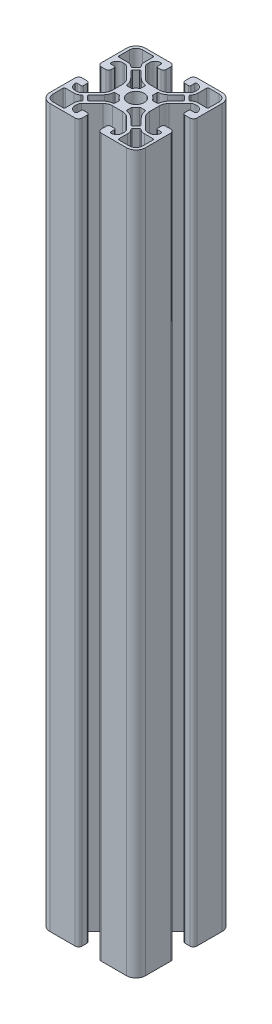
from build123d import *

# Parameters (mm, degrees)
BOSS_EXTRUDE1_DEPTH = 300


with BuildPart() as part:
    # Sketch1 → Boss-Extrude1 (new body)
    with BuildSketch(Plane.XZ):
        with BuildLine():
            ThreePointArc((7.74999966, 2.143146426), (8.054481613, 3.673880349), (8.921572842, 4.971573842))
            Line((8.921572842, 4.971573842), (13.364213585, 9.414213585))
            ThreePointArc((13.364213585, 9.414213585), (14.013060246, 9.847758984), (14.778427028, 9.99999988))
            Line((14.778427028, 9.99999988), (15.49999999, 9.99999988))
            ThreePointArc((15.49999999, 9.99999988), (17.267766945, 9.267766835), (18, 7.499999885))
            ThreePointArc((18, 7.499999885), (17.853553391, 7.146446491), (17.499999998, 6.99999988))
            Line((17.499999998, 6.99999988), (16.000000002, 6.99999988))
            ThreePointArc((16.000000002, 6.99999988), (15.64644661, 6.85355327), (15.5, 6.499999878))
            Line((15.5, 6.499999878), (15.5, 4.999999884))
            ThreePointArc((15.5, 4.999999884), (15.79289322, 4.2928931), (16.500000004, 3.99999988))
            Line((16.500000004, 3.99999988), (18.499999994, 3.99999988))
            ThreePointArc((18.499999994, 3.99999988), (19.56066017, 4.43933971), (20, 5.499999886))
            Line((20, 5.499999886), (20, 16))
            ThreePointArc((20, 16), (18.828427125, 18.828427125), (16, 20))
            Line((16, 20), (5.500000703, 20))
            ThreePointArc((5.500000703, 20), (4.439339115, 19.560659585), (3.9999987, 18.499997997))
            Line((3.9999987, 18.499997997), (3.9999987, 16.500000004))
            ThreePointArc((3.9999987, 16.500000004), (4.29289192, 15.79289322), (4.999998704, 15.5))
            Line((4.999998704, 15.5), (6.499998698, 15.5))
            ThreePointArc((6.499998698, 15.5), (6.85355209, 15.64644661), (6.9999987, 16.000000002))
            Line((6.9999987, 16.000000002), (6.9999987, 17.499999998))
            ThreePointArc((6.9999987, 17.499999998), (7.146445288, 17.853553368), (7.49999864, 18))
            ThreePointArc((7.49999864, 18), (9.2677658, 17.26776706), (9.99999896, 15.49999999))
            Line((9.99999896, 15.49999999), (9.99999896, 14.778427028))
            ThreePointArc((9.99999896, 14.778427028), (9.847758064, 14.013060246), (9.414212665, 13.364213585))
            Line((9.414212665, 13.364213585), (4.971572922, 8.921572842))
            ThreePointArc((4.971572922, 8.921572842), (3.673879429, 8.054481613), (2.143145506, 7.74999966))
            Line((2.143145506, 7.74999966), (-2.143146426, 7.74999966))
            ThreePointArc((-2.143146426, 7.74999966), (-3.673880349, 8.054481613), (-4.971573842, 8.921572842))
            Line((-4.971573842, 8.921572842), (-9.414213585, 13.364213585))
            ThreePointArc((-9.414213585, 13.364213585), (-9.847758984, 14.013060246), (-9.99999988, 14.778427028))
            Line((-9.99999988, 14.778427028), (-9.99999988, 15.49999999))
            ThreePointArc((-9.99999988, 15.49999999), (-9.267766835, 17.267766945), (-7.499999885, 18))
            ThreePointArc((-7.499999885, 18), (-7.146446491, 17.853553391), (-6.99999988, 17.499999998))
            Line((-6.99999988, 17.499999998), (-6.99999988, 16.000000002))
            ThreePointArc((-6.99999988, 16.000000002), (-6.85355327, 15.64644661), (-6.499999878, 15.5))
            Line((-6.499999878, 15.5), (-4.999999884, 15.5))
            ThreePointArc((-4.999999884, 15.5), (-4.2928931, 15.79289322), (-3.99999988, 16.500000004))
            Line((-3.99999988, 16.500000004), (-3.99999988, 18.499999994))
            ThreePointArc((-3.99999988, 18.499999994), (-4.43933971, 19.56066017), (-5.499999886, 20))
            Line((-5.499999886, 20), (-16, 20))
            ThreePointArc((-16, 20), (-18.828427125, 18.828427125), (-20, 16))
            Line((-20, 16), (-20, 5.500000703))
            ThreePointArc((-20, 5.500000703), (-19.560659585, 4.439339115), (-18.499997997, 3.9999987))
            Line((-18.499997997, 3.9999987), (-16.500000004, 3.9999987))
            ThreePointArc((-16.500000004, 3.9999987), (-15.79289322, 4.29289192), (-15.5, 4.999998704))
            Line((-15.5, 4.999998704), (-15.5, 6.499998698))
            ThreePointArc((-15.5, 6.499998698), (-15.64644661, 6.85355209), (-16.000000002, 6.9999987))
            Line((-16.000000002, 6.9999987), (-17.499999998, 6.9999987))
            ThreePointArc((-17.499999998, 6.9999987), (-17.853553368, 7.146445288), (-18, 7.49999864))
            ThreePointArc((-18, 7.49999864), (-17.26776706, 9.2677658), (-15.49999999, 9.99999896))
            Line((-15.49999999, 9.99999896), (-14.778427028, 9.99999896))
            ThreePointArc((-14.778427028, 9.99999896), (-14.013060246, 9.847758064), (-13.364213585, 9.414212665))
            Line((-13.364213585, 9.414212665), (-8.921572842, 4.971572922))
            ThreePointArc((-8.921572842, 4.971572922), (-8.054481613, 3.673879429), (-7.74999966, 2.143145506))
            Line((-7.74999966, 2.143145506), (-7.74999966, -2.143146426))
            ThreePointArc((-7.74999966, -2.143146426), (-8.054481613, -3.673880349), (-8.921572842, -4.971573842))
            Line((-8.921572842, -4.971573842), (-13.364213585, -9.414213585))
            ThreePointArc((-13.364213585, -9.414213585), (-14.013060246, -9.847758984), (-14.778427028, -9.99999988))
            Line((-14.778427028, -9.99999988), (-15.49999999, -9.99999988))
            ThreePointArc((-15.49999999, -9.99999988), (-17.267766945, -9.267766835), (-18, -7.499999885))
            ThreePointArc((-18, -7.499999885), (-17.853553391, -7.146446491), (-17.499999998, -6.99999988))
            Line((-17.499999998, -6.99999988), (-16.000000002, -6.99999988))
            ThreePointArc((-16.000000002, -6.99999988), (-15.64644661, -6.85355327), (-15.5, -6.499999878))
            Line((-15.5, -6.499999878), (-15.5, -4.999999884))
            ThreePointArc((-15.5, -4.999999884), (-15.79289322, -4.2928931), (-16.500000004, -3.99999988))
            Line((-16.500000004, -3.99999988), (-18.499999994, -3.99999988))
            ThreePointArc((-18.499999994, -3.99999988), (-19.56066017, -4.43933971), (-20, -5.499999886))
            Line((-20, -5.499999886), (-20, -16))
            ThreePointArc((-20, -16), (-18.828427125, -18.828427125), (-16, -20))
            Line((-16, -20), (-5.500000703, -20))
            ThreePointArc((-5.500000703, -20), (-4.439339115, -19.560659585), (-3.9999987, -18.499997997))
            Line((-3.9999987, -18.499997997), (-3.9999987, -16.500000004))
            ThreePointArc((-3.9999987, -16.500000004), (-4.29289192, -15.79289322), (-4.999998704, -15.5))
            Line((-4.999998704, -15.5), (-6.499998698, -15.5))
            ThreePointArc((-6.499998698, -15.5), (-6.85355209, -15.64644661), (-6.9999987, -16.000000002))
            Line((-6.9999987, -16.000000002), (-6.9999987, -17.499999998))
            ThreePointArc((-6.9999987, -17.499999998), (-7.146445288, -17.853553368), (-7.49999864, -18))
            ThreePointArc((-7.49999864, -18), (-9.2677658, -17.26776706), (-9.99999896, -15.49999999))
            Line((-9.99999896, -15.49999999), (-9.99999896, -14.778427028))
            ThreePointArc((-9.99999896, -14.778427028), (-9.847758064, -14.013060246), (-9.414212665, -13.364213585))
            Line((-9.414212665, -13.364213585), (-4.971572922, -8.921572842))
            ThreePointArc((-4.971572922, -8.921572842), (-3.673879429, -8.054481613), (-2.143145506, -7.74999966))
            Line((-2.143145506, -7.74999966), (2.143146426, -7.74999966))
            ThreePointArc((2.143146426, -7.74999966), (3.673880349, -8.054481613), (4.971573842, -8.921572842))
            Line((4.971573842, -8.921572842), (9.414213585, -13.364213585))
            ThreePointArc((9.414213585, -13.364213585), (9.847758984, -14.013060246), (9.99999988, -14.778427028))
            Line((9.99999988, -14.778427028), (9.99999988, -15.49999999))
            ThreePointArc((9.99999988, -15.49999999), (9.267766835, -17.267766945), (7.499999885, -18))
            ThreePointArc((7.499999885, -18), (7.146446491, -17.853553391), (6.99999988, -17.499999998))
            Line((6.99999988, -17.499999998), (6.99999988, -16.000000002))
            ThreePointArc((6.99999988, -16.000000002), (6.85355327, -15.64644661), (6.499999878, -15.5))
            Line((6.499999878, -15.5), (4.999999884, -15.5))
            ThreePointArc((4.999999884, -15.5), (4.2928931, -15.79289322), (3.99999988, -16.500000004))
            Line((3.99999988, -16.500000004), (3.99999988, -18.499999994))
            ThreePointArc((3.99999988, -18.499999994), (4.43933971, -19.56066017), (5.499999886, -20))
            Line((5.499999886, -20), (16, -20))
            ThreePointArc((16, -20), (18.828427125, -18.828427125), (20, -16))
            Line((20, -16), (20, -5.500000703))
            ThreePointArc((20, -5.500000703), (19.560659585, -4.439339115), (18.499997997, -3.9999987))
            Line((18.499997997, -3.9999987), (16.500000004, -3.9999987))
            ThreePointArc((16.500000004, -3.9999987), (15.79289322, -4.29289192), (15.5, -4.999998704))
            Line((15.5, -4.999998704), (15.5, -6.499998698))
            ThreePointArc((15.5, -6.499998698), (15.64644661, -6.85355209), (16.000000002, -6.9999987))
            Line((16.000000002, -6.9999987), (17.499999998, -6.9999987))
            ThreePointArc((17.499999998, -6.9999987), (17.853553368, -7.146445288), (18, -7.49999864))
            ThreePointArc((18, -7.49999864), (17.26776706, -9.2677658), (15.49999999, -9.99999896))
            Line((15.49999999, -9.99999896), (14.778427028, -9.99999896))
            ThreePointArc((14.778427028, -9.99999896), (14.013060246, -9.847758064), (13.364213585, -9.414212665))
            Line((13.364213585, -9.414212665), (8.921572842, -4.971572922))
            ThreePointArc((8.921572842, -4.971572922), (8.054481613, -3.673879429), (7.74999966, -2.143145506))
            Line((7.74999966, -2.143145506), (7.74999966, 2.143146426))
        make_face()
        with BuildLine():
            Line((-10.309842412, -12.441125736), (-10.537754292, -12.737838278))
            ThreePointArc((-10.537754292, -12.737838278), (-11.029918756, -13.657781351), (-11.20000018, -14.687146897))
            Line((-11.20000018, -14.687146897), (-11.20000018, -18.299999665))
            ThreePointArc((-11.20000018, -18.299999665), (-11.346446785, -18.653553045), (-11.700000165, -18.79999965))
            Line((-11.700000165, -18.79999965), (-15.999998999, -18.79999965))
            ThreePointArc((-15.999998999, -18.79999965), (-17.97989798, -17.97989864), (-18.79999899, -15.999999659))
            Line((-18.79999899, -15.999999659), (-18.79999899, -11.700000652))
            ThreePointArc((-18.79999899, -11.700000652), (-18.65355238, -11.34644726), (-18.299998988, -11.20000065))
            Line((-18.299998988, -11.20000065), (-14.687147242, -11.20000065))
            ThreePointArc((-14.687147242, -11.20000065), (-13.657781701, -11.029919227), (-12.737838631, -10.537754765))
            Line((-12.737838631, -10.537754765), (-12.441126454, -10.309843165))
            ThreePointArc((-12.441126454, -10.309843165), (-12.103969645, -10.207429365), (-11.782992043, -10.352813957))
            Line((-11.782992043, -10.352813957), (-10.352813101, -11.782992899))
            ThreePointArc((-10.352813101, -11.782992899), (-10.207428857, -12.103969733), (-10.309842412, -12.441125736))
        make_face(mode=Mode.SUBTRACT)
        with BuildLine():
            Line((-2.49999982, -4.612548562), (-2.49999982, -6.181005536))
            ThreePointArc((-2.49999982, -6.181005536), (-2.622288189, -6.508624104), (-2.929335517, -6.675986912))
            ThreePointArc((-2.929335517, -6.675986912), (-4.217639104, -7.033530984), (-5.372191903, -7.707750332))
            ThreePointArc((-5.372191903, -7.707750332), (-7.142926579, -9.204438637), (-8.77441042, -10.851811592))
            ThreePointArc((-8.77441042, -10.851811592), (-9.132617059, -11.015888701), (-9.498445987, -10.869592803))
            Line((-9.498445987, -10.869592803), (-10.869594172, -9.498444618))
            ThreePointArc((-10.869594172, -9.498444618), (-11.01589007, -9.132615689), (-10.851812962, -8.774409049))
            ThreePointArc((-10.851812962, -8.774409049), (-9.204439994, -7.142925196), (-7.707751679, -5.372190504))
            ThreePointArc((-7.707751679, -5.372190504), (-7.03353234, -4.217637712), (-6.67598828, -2.929334132))
            ThreePointArc((-6.67598828, -2.929334132), (-6.50862548, -2.622286815), (-6.181006925, -2.49999845))
            Line((-6.181006925, -2.49999845), (-4.612550475, -2.49999845))
            ThreePointArc((-4.612550475, -2.49999845), (-4.374103707, -2.560517653), (-4.193379151, -2.727425022))
            ThreePointArc((-4.193379151, -2.727425022), (-3.537216107, -3.537215713), (-2.727425489, -4.193378848))
            ThreePointArc((-2.727425489, -4.193378848), (-2.560518782, -4.374102717), (-2.49999982, -4.612548562))
        make_face(mode=Mode.SUBTRACT)
        with BuildLine():
            Line((12.441125736, -10.309842412), (12.737838278, -10.537754292))
            ThreePointArc((12.737838278, -10.537754292), (13.657781351, -11.029918756), (14.687146897, -11.20000018))
            Line((14.687146897, -11.20000018), (18.299999665, -11.20000018))
            ThreePointArc((18.299999665, -11.20000018), (18.653553045, -11.346446785), (18.79999965, -11.700000165))
            Line((18.79999965, -11.700000165), (18.79999965, -15.999998999))
            ThreePointArc((18.79999965, -15.999998999), (17.97989864, -17.97989798), (15.999999659, -18.79999899))
            Line((15.999999659, -18.79999899), (11.700000652, -18.79999899))
            ThreePointArc((11.700000652, -18.79999899), (11.34644726, -18.65355238), (11.20000065, -18.299998988))
            Line((11.20000065, -18.299998988), (11.20000065, -14.687147242))
            ThreePointArc((11.20000065, -14.687147242), (11.029919227, -13.657781701), (10.537754765, -12.737838631))
            Line((10.537754765, -12.737838631), (10.309843165, -12.441126454))
            ThreePointArc((10.309843165, -12.441126454), (10.207429365, -12.103969645), (10.352813957, -11.782992043))
            Line((10.352813957, -11.782992043), (11.782992899, -10.352813101))
            ThreePointArc((11.782992899, -10.352813101), (12.103969733, -10.207428857), (12.441125736, -10.309842412))
        make_face(mode=Mode.SUBTRACT)
        with BuildLine():
            Line((4.612548562, -2.49999982), (6.181005536, -2.49999982))
            ThreePointArc((6.181005536, -2.49999982), (6.508624104, -2.622288189), (6.675986912, -2.929335517))
            ThreePointArc((6.675986912, -2.929335517), (7.033530984, -4.217639104), (7.707750332, -5.372191903))
            ThreePointArc((7.707750332, -5.372191903), (9.204438637, -7.142926579), (10.851811592, -8.77441042))
            ThreePointArc((10.851811592, -8.77441042), (11.015888701, -9.132617059), (10.869592803, -9.498445987))
            Line((10.869592803, -9.498445987), (9.498444618, -10.869594172))
            ThreePointArc((9.498444618, -10.869594172), (9.132615689, -11.01589007), (8.774409049, -10.851812962))
            ThreePointArc((8.774409049, -10.851812962), (7.142925196, -9.204439994), (5.372190504, -7.707751679))
            ThreePointArc((5.372190504, -7.707751679), (4.217637712, -7.03353234), (2.929334132, -6.67598828))
            ThreePointArc((2.929334132, -6.67598828), (2.622286815, -6.50862548), (2.49999845, -6.181006925))
            Line((2.49999845, -6.181006925), (2.49999845, -4.612550475))
            ThreePointArc((2.49999845, -4.612550475), (2.560517653, -4.374103707), (2.727425022, -4.193379151))
            ThreePointArc((2.727425022, -4.193379151), (3.537215713, -3.537216107), (4.193378848, -2.727425489))
            ThreePointArc((4.193378848, -2.727425489), (4.374102717, -2.560518782), (4.612548562, -2.49999982))
        make_face(mode=Mode.SUBTRACT)
        with BuildLine():
            Line((-4.612548562, 2.49999982), (-6.181005536, 2.49999982))
            ThreePointArc((-6.181005536, 2.49999982), (-6.508624104, 2.622288189), (-6.675986912, 2.929335517))
            ThreePointArc((-6.675986912, 2.929335517), (-7.033530984, 4.217639104), (-7.707750332, 5.372191903))
            ThreePointArc((-7.707750332, 5.372191903), (-9.204438637, 7.142926579), (-10.851811592, 8.77441042))
            ThreePointArc((-10.851811592, 8.77441042), (-11.015888701, 9.132617059), (-10.869592803, 9.498445987))
            Line((-10.869592803, 9.498445987), (-9.498444618, 10.869594172))
            ThreePointArc((-9.498444618, 10.869594172), (-9.132615689, 11.01589007), (-8.774409049, 10.851812962))
            ThreePointArc((-8.774409049, 10.851812962), (-7.142925196, 9.204439994), (-5.372190504, 7.707751679))
            ThreePointArc((-5.372190504, 7.707751679), (-4.217637712, 7.03353234), (-2.929334132, 6.67598828))
            ThreePointArc((-2.929334132, 6.67598828), (-2.622286815, 6.50862548), (-2.49999845, 6.181006925))
            Line((-2.49999845, 6.181006925), (-2.49999845, 4.612550475))
            ThreePointArc((-2.49999845, 4.612550475), (-2.560517653, 4.374103707), (-2.727425022, 4.193379151))
            ThreePointArc((-2.727425022, 4.193379151), (-3.537215713, 3.537216107), (-4.193378848, 2.727425489))
            ThreePointArc((-4.193378848, 2.727425489), (-4.374102717, 2.560518782), (-4.612548562, 2.49999982))
        make_face(mode=Mode.SUBTRACT)
        with BuildLine():
            Line((-12.441125736, 10.309842412), (-12.737838278, 10.537754292))
            ThreePointArc((-12.737838278, 10.537754292), (-13.657781351, 11.029918756), (-14.687146897, 11.20000018))
            Line((-14.687146897, 11.20000018), (-18.299999665, 11.20000018))
            ThreePointArc((-18.299999665, 11.20000018), (-18.653553045, 11.346446785), (-18.79999965, 11.700000165))
            Line((-18.79999965, 11.700000165), (-18.79999965, 15.999998999))
            ThreePointArc((-18.79999965, 15.999998999), (-17.97989864, 17.97989798), (-15.999999659, 18.79999899))
            Line((-15.999999659, 18.79999899), (-11.700000652, 18.79999899))
            ThreePointArc((-11.700000652, 18.79999899), (-11.34644726, 18.65355238), (-11.20000065, 18.299998988))
            Line((-11.20000065, 18.299998988), (-11.20000065, 14.687147242))
            ThreePointArc((-11.20000065, 14.687147242), (-11.029919227, 13.657781701), (-10.537754765, 12.737838631))
            Line((-10.537754765, 12.737838631), (-10.309843165, 12.441126454))
            ThreePointArc((-10.309843165, 12.441126454), (-10.207429365, 12.103969645), (-10.352813957, 11.782992043))
            Line((-10.352813957, 11.782992043), (-11.782992899, 10.352813101))
            ThreePointArc((-11.782992899, 10.352813101), (-12.103969733, 10.207428857), (-12.441125736, 10.309842412))
        make_face(mode=Mode.SUBTRACT)
        with BuildLine():
            ThreePointArc((-3.4, 0), (-2.404163056, 2.404163056), (0, 3.4))
            ThreePointArc((0, 3.4), (2.404163056, 2.404163056), (3.4, 0))
            ThreePointArc((3.4, 0), (2.404163056, -2.404163056), (0, -3.4))
            ThreePointArc((0, -3.4), (-2.404163056, -2.404163056), (-3.4, 0))
        make_face(mode=Mode.SUBTRACT)
        with BuildLine():
            Line((2.49999982, 4.612548562), (2.49999982, 6.181005536))
            ThreePointArc((2.49999982, 6.181005536), (2.622288189, 6.508624104), (2.929335517, 6.675986912))
            ThreePointArc((2.929335517, 6.675986912), (4.217639104, 7.033530984), (5.372191903, 7.707750332))
            ThreePointArc((5.372191903, 7.707750332), (7.142926579, 9.204438637), (8.77441042, 10.851811592))
            ThreePointArc((8.77441042, 10.851811592), (9.132617059, 11.015888701), (9.498445987, 10.869592803))
            Line((9.498445987, 10.869592803), (10.869594172, 9.498444618))
            ThreePointArc((10.869594172, 9.498444618), (11.01589007, 9.132615689), (10.851812962, 8.774409049))
            ThreePointArc((10.851812962, 8.774409049), (9.204439994, 7.142925196), (7.707751679, 5.372190504))
            ThreePointArc((7.707751679, 5.372190504), (7.03353234, 4.217637712), (6.67598828, 2.929334132))
            ThreePointArc((6.67598828, 2.929334132), (6.50862548, 2.622286815), (6.181006925, 2.49999845))
            Line((6.181006925, 2.49999845), (4.612550475, 2.49999845))
            ThreePointArc((4.612550475, 2.49999845), (4.374103707, 2.560517653), (4.193379151, 2.727425022))
            ThreePointArc((4.193379151, 2.727425022), (3.537216107, 3.537215713), (2.727425489, 4.193378848))
            ThreePointArc((2.727425489, 4.193378848), (2.560518782, 4.374102717), (2.49999982, 4.612548562))
        make_face(mode=Mode.SUBTRACT)
        with BuildLine():
            Line((10.309842412, 12.441125736), (10.537754292, 12.737838278))
            ThreePointArc((10.537754292, 12.737838278), (11.029918756, 13.657781351), (11.20000018, 14.687146897))
            Line((11.20000018, 14.687146897), (11.20000018, 18.299999665))
            ThreePointArc((11.20000018, 18.299999665), (11.346446785, 18.653553045), (11.700000165, 18.79999965))
            Line((11.700000165, 18.79999965), (15.999998999, 18.79999965))
            ThreePointArc((15.999998999, 18.79999965), (17.97989798, 17.97989864), (18.79999899, 15.999999659))
            Line((18.79999899, 15.999999659), (18.79999899, 11.700000652))
            ThreePointArc((18.79999899, 11.700000652), (18.65355238, 11.34644726), (18.299998988, 11.20000065))
            Line((18.299998988, 11.20000065), (14.687147242, 11.20000065))
            ThreePointArc((14.687147242, 11.20000065), (13.657781701, 11.029919227), (12.737838631, 10.537754765))
            Line((12.737838631, 10.537754765), (12.441126454, 10.309843165))
            ThreePointArc((12.441126454, 10.309843165), (12.103969645, 10.207429365), (11.782992043, 10.352813957))
            Line((11.782992043, 10.352813957), (10.352813101, 11.782992899))
            ThreePointArc((10.352813101, 11.782992899), (10.207428857, 12.103969733), (10.309842412, 12.441125736))
        make_face(mode=Mode.SUBTRACT)
    extrude(amount=-BOSS_EXTRUDE1_DEPTH)


solid = part.part
